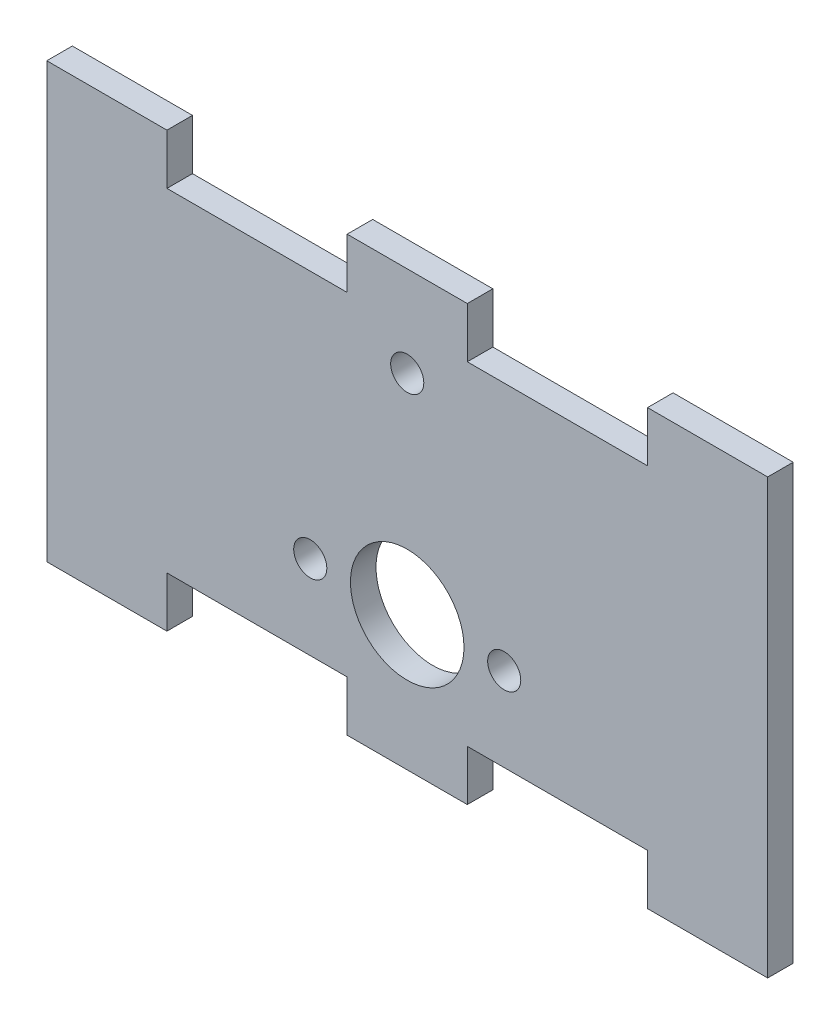
from build123d import *

# Parameters (mm, degrees)
SKETCH1_W          = 76.2
SKETCH1_H          = 35.2
BASE_SHAPE_DEPTH   = 2.7
SKETCH2_R          = 6
SKETCH2_R_2        = 1.75
MOTOR_HOLES_DEPTH  = 43.055439601
SKETCH3_W          = 12.7
SKETCH3_H          = 2.7
TOP_TEETH_DEPTH    = 5.334
SKETCH4_W          = 12.7
SKETCH4_H          = 2.7
BOTTOM_TEETH_DEPTH = 5.334


with BuildPart() as part:
    # Sketch1 → Base Shape (new body)
    with BuildSketch(Plane.XY):
        Rectangle(SKETCH1_W, SKETCH1_H)
    extrude(amount=-BASE_SHAPE_DEPTH)

    # Sketch2 → Motor Holes (cut, through all)
    with BuildSketch(Plane.XY):
        with Locations((0, -8.73)):
            Circle(SKETCH2_R)
        with Locations((-10.25, -8.73)):
            Circle(SKETCH2_R_2)
        with Locations((10.25, -8.73)):
            Circle(SKETCH2_R_2)
        with Locations((0, 13.369999996)):
            Circle(SKETCH2_R_2)
    extrude(amount=-MOTOR_HOLES_DEPTH, mode=Mode.SUBTRACT)

    # Sketch3 → Top teeth (add)
    with BuildSketch(Plane(origin=(0, 17.6, 0), x_dir=(1, 0, 0), z_dir=(0, 1, 0))):
        with Locations((-31.75, 1.35)):
            Rectangle(SKETCH3_W, SKETCH3_H)
        with Locations((0, 1.35)):
            Rectangle(SKETCH3_W, SKETCH3_H)
        with Locations((31.75, 1.35)):
            Rectangle(SKETCH3_W, SKETCH3_H)
    extrude(amount=TOP_TEETH_DEPTH)

    # Sketch4 → Bottom teeth (add)
    with BuildSketch(Plane.XZ.offset(17.6)):
        with Locations((-31.75, -1.35)):
            Rectangle(SKETCH4_W, SKETCH4_H)
        with Locations((0, -1.35)):
            Rectangle(SKETCH4_W, SKETCH4_H)
        with Locations((31.75, -1.35)):
            Rectangle(SKETCH4_W, SKETCH4_H)
    extrude(amount=BOTTOM_TEETH_DEPTH)


solid = part.part
